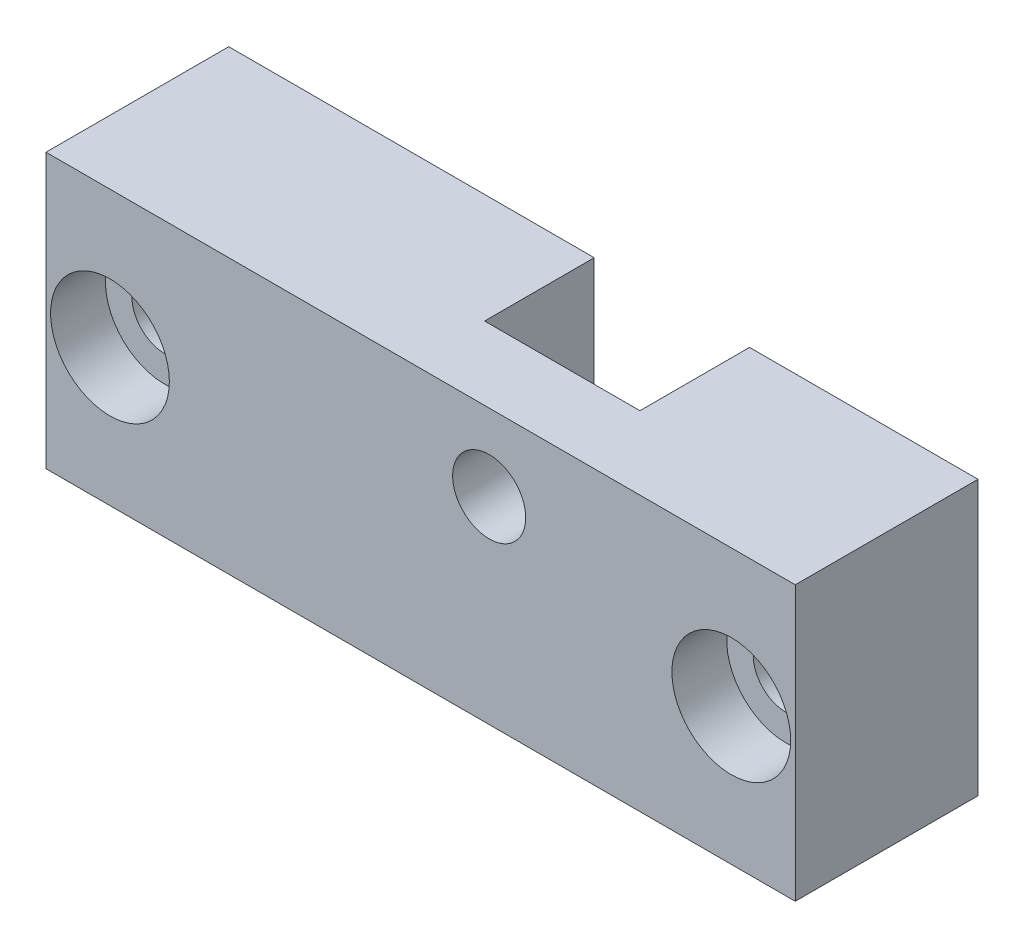
from build123d import *

# Parameters (mm, degrees)
SKETCH_1_W                   = 41
SKETCH_1_H                   = 15
EXTRUDE_1_DEPTH              = 10
HOLE_WIZARD_M3_1_D           = 3.6
HOLE_WIZARD_M3_1_CBORE_D     = 6.5
HOLE_WIZARD_M3_1_CBORE_DEPTH = 3
SKETCH_4_W                   = 8.5
SKETCH_4_H                   = 6
CUT_EXTRUDE_1_DEPTH          = 45.788391353
SKETCH_5_R                   = 2
CUT_EXTRUDE_2_DEPTH          = 10


with BuildPart() as part:
    # 草图1 → 凸台-拉伸1 (new body)
    with BuildSketch(Plane.XY):
        with Locations((20.5, 7.5)):
            Rectangle(SKETCH_1_W, SKETCH_1_H)
    extrude(amount=EXTRUDE_1_DEPTH)

    # M3 六角凹头螺钉的柱形沉头孔1 (through all)
    with Locations(Plane.XY.offset(10)):
        with Locations((3.5, 7.5), (37.5, 7.5)):
            CounterBoreHole(HOLE_WIZARD_M3_1_D / 2, HOLE_WIZARD_M3_1_CBORE_D / 2, HOLE_WIZARD_M3_1_CBORE_DEPTH)

    # 草图4 → 切除-拉伸1 (cut, through all)
    with BuildSketch(Plane(origin=(0, 15, 0), x_dir=(1, 0, 0), z_dir=(0, 1, 0))):
        with Locations((24.25, -3)):
            Rectangle(SKETCH_4_W, SKETCH_4_H)
    extrude(amount=-CUT_EXTRUDE_1_DEPTH, mode=Mode.SUBTRACT)

    # 草图5 → 切除-拉伸2 (cut)
    with BuildSketch(Plane(origin=(0, 0, 6), x_dir=(-1, 0, 0), z_dir=(0, 0, -1))):
        with Locations((-24.25, 10.8)):
            Circle(SKETCH_5_R)
    extrude(amount=-CUT_EXTRUDE_2_DEPTH, mode=Mode.SUBTRACT)


solid = part.part
